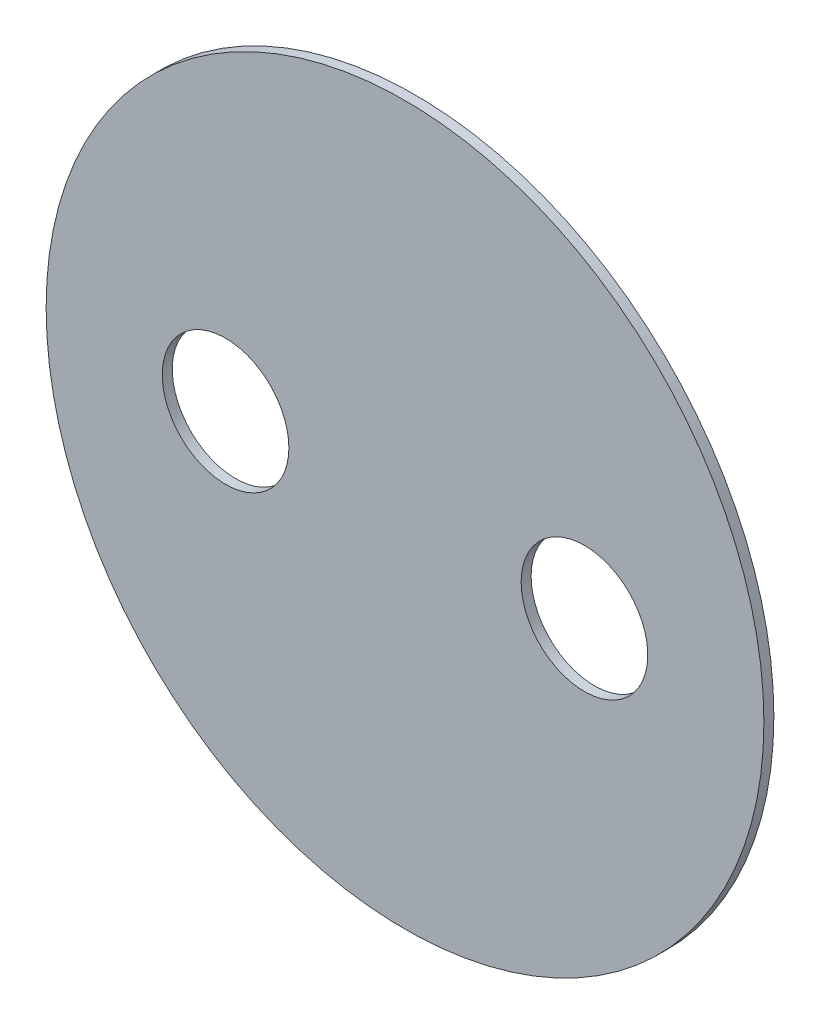
from build123d import *

# Parameters (mm, degrees)
SKETCH1_R           = 36
SKETCH1_R_2         = 6.35
BOSS_EXTRUDE1_DEPTH = 1


with BuildPart() as part:
    # Sketch1 → Boss-Extrude1 (new body)
    with BuildSketch(Plane.XY):
        Circle(SKETCH1_R)
        with Locations((-18, 0)):
            Circle(SKETCH1_R_2, mode=Mode.SUBTRACT)
        with Locations(Location((18, 0, 0), (0, 0, 180))):
            Circle(SKETCH1_R_2, mode=Mode.SUBTRACT)
    extrude(amount=BOSS_EXTRUDE1_DEPTH)


solid = part.part
